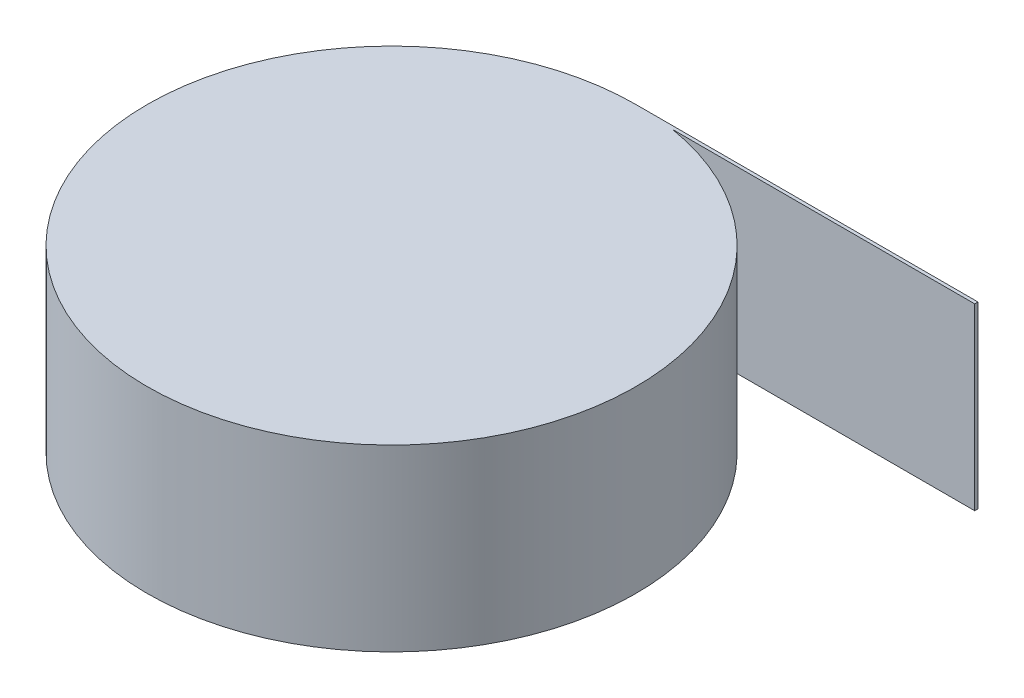
from build123d import *

# Parameters (mm, degrees)
BOSS_EXTRUDE1_DEPTH = 13.97


with BuildPart() as part:
    # Sketch1 → Boss-Extrude1 (new body)
    with BuildSketch(Plane(origin=(0, 0, 0), x_dir=(1, 0, 0), z_dir=(0, 1, 0))):
        with BuildLine():
            Line((0, 19.05), (26.67, 19.05))
            Line((26.67, 19.05), (26.67, 18.796))
            Line((26.67, 18.796), (3.100465126, 18.796))
            ThreePointArc((3.100465126, 18.796), (-1.555425987, -18.986393812), (0, 19.05))
        make_face()
    extrude(amount=BOSS_EXTRUDE1_DEPTH)


solid = part.part
